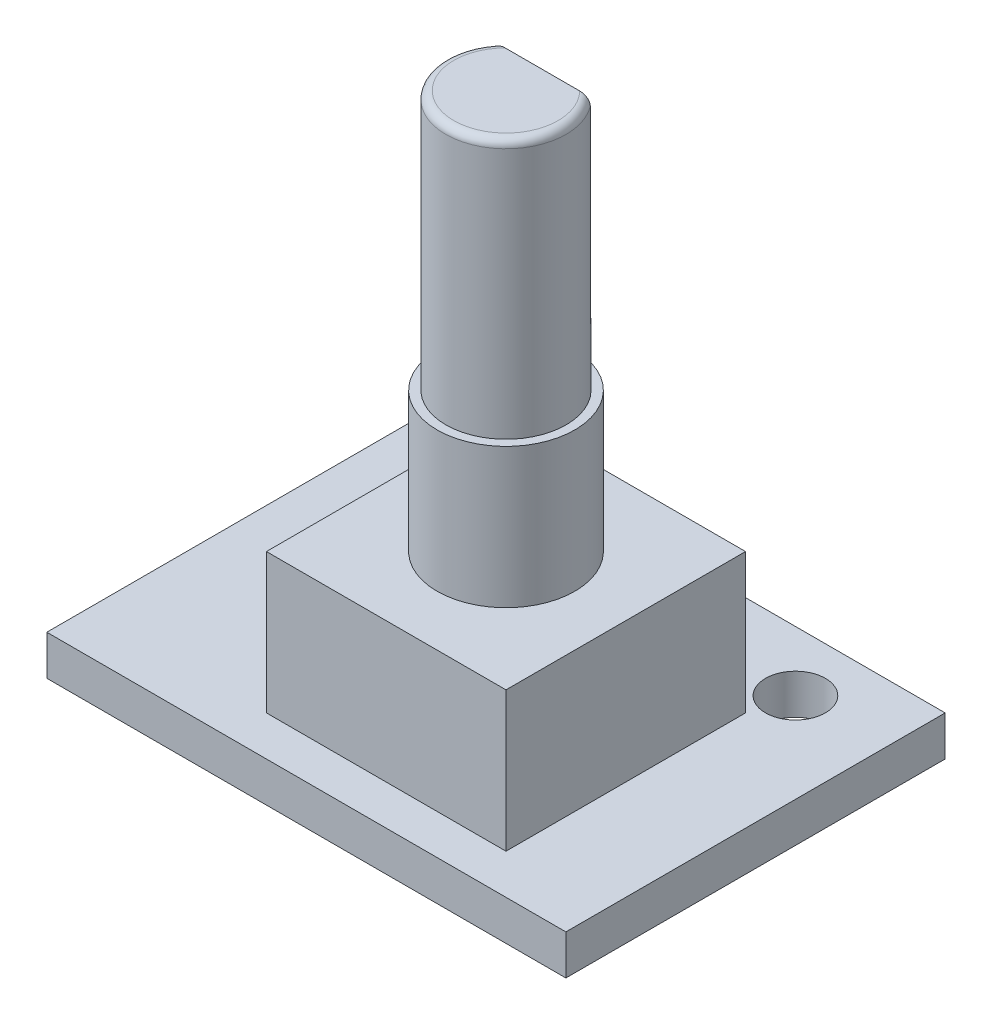
from build123d import *

# Parameters (mm, degrees)
SKETCH1_W           = 26
SKETCH1_H           = 19
BOSS_EXTRUDE1_DEPTH = 2
SKETCH2_W           = 12
SKETCH2_H           = 12
BOSS_EXTRUDE2_DEPTH = 7
SKETCH3_R           = 3.45
BOSS_EXTRUDE3_DEPTH = 7
SKETCH4_R           = 3.013235608
BOSS_EXTRUDE4_DEPTH = 13
CUT_EXTRUDE1_START  = -10
CUT_EXTRUDE1_DEPTH  = 10
FILLET1_R           = 0.4
SKETCH6_R           = 1.5
CUT_EXTRUDE2_DEPTH  = 43.023802843


with BuildPart() as part:
    # Sketch1 → Boss-Extrude1 (new body)
    with BuildSketch(Plane(origin=(0, 0, 0), x_dir=(1, 0, 0), z_dir=(0, 1, 0))):
        with Locations((13, 9.5)):
            Rectangle(SKETCH1_W, SKETCH1_H)
    extrude(amount=BOSS_EXTRUDE1_DEPTH)

    # Sketch2 → Boss-Extrude2 (add)
    with BuildSketch(Plane(origin=(0, 2, 0), x_dir=(1, 0, 0), z_dir=(0, 1, 0))):
        with Locations((15, 8)):
            Rectangle(SKETCH2_W, SKETCH2_H)
    extrude(amount=BOSS_EXTRUDE2_DEPTH)

    # Sketch3 → Boss-Extrude3 (add)
    with BuildSketch(Plane(origin=(0, 9, 0), x_dir=(1, 0, 0), z_dir=(0, 1, 0))):
        with Locations(Location((15, 8, 0), (0, 0, 270))):
            Circle(SKETCH3_R)
    extrude(amount=BOSS_EXTRUDE3_DEPTH)

    # Sketch4 → Boss-Extrude4 (add)
    with BuildSketch(Plane(origin=(0, 16, 0), x_dir=(1, 0, 0), z_dir=(0, 1, 0))):
        with Locations(Location((15, 8, 0), (0, 0, 90))):
            Circle(SKETCH4_R)
    extrude(amount=BOSS_EXTRUDE4_DEPTH)

    # Sketch5 → Cut-Extrude1 (cut)
    with BuildSketch(Plane(origin=(0, 29, 0), x_dir=(1, 0, 0), z_dir=(0, 1, 0)).offset(CUT_EXTRUDE1_START)):
        with BuildLine():
            Line((12.603290186, 9.826299784), (17.396709814, 9.826299784))
            ThreePointArc((17.396709814, 9.826299784), (15, 11.013235608), (12.603290186, 9.826299784))
        make_face()
    extrude(amount=CUT_EXTRUDE1_DEPTH, mode=Mode.SUBTRACT)

    # Fillet1
    fillet1_edges = [part.edges().sort_by_distance(p)[0] for p in [
        (15, 29, -4.986764392),
    ]]
    fillet(fillet1_edges, radius=FILLET1_R)

    # Sketch6 → Cut-Extrude2 (cut, through all)
    with BuildSketch(Plane(origin=(0, 2, 0), x_dir=(1, 0, 0), z_dir=(0, 1, 0))):
        with Locations(Location((21.5, 16, 0), (0, 0, 270))):
            Circle(SKETCH6_R)
        with Locations(Location((4.5, 16, 0), (0, 0, 270))):
            Circle(SKETCH6_R)
    extrude(amount=-CUT_EXTRUDE2_DEPTH, mode=Mode.SUBTRACT)


solid = part.part
